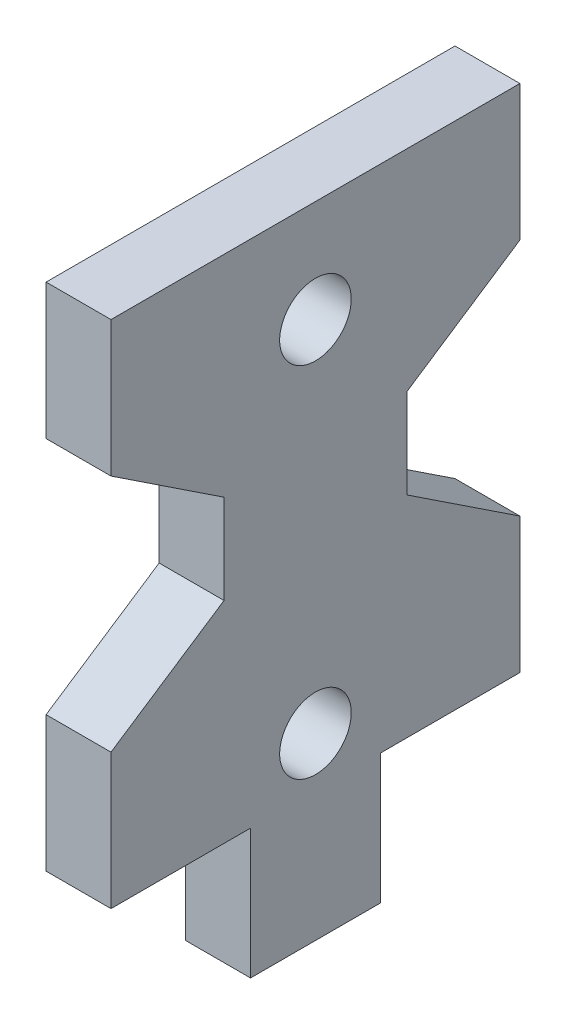
from build123d import *

# Parameters (mm, degrees)
SKETCH1_R           = 1.75
BOSS_EXTRUDE1_DEPTH = 3.175


with BuildPart() as part:
    # Sketch1 → Boss-Extrude1 (new body)
    with BuildSketch(Plane(origin=(0, 0, 0), x_dir=(0, 0, -1), z_dir=(1, 0, 0))):
        Polygon((0, 0), (6.825, 0), (6.825, -6.35), (13.175, -6.35), (13.175, 0), (20, 0), (20, 6.629574014), (14.471500996, 10.288392178), (14.471500996, 14.663602622), (20, 18.322420786), (20, 24.9519948), (0, 24.9519948), (0, 18.322420786), (5.528499004, 14.663602622), (5.528499004, 10.288392178), (0, 6.629574014), align=None)
        with Locations((10, 19.9519948)):
            Circle(SKETCH1_R, mode=Mode.SUBTRACT)
        with Locations((10, 2.4259948)):
            Circle(SKETCH1_R, mode=Mode.SUBTRACT)
    extrude(amount=BOSS_EXTRUDE1_DEPTH)


solid = part.part
